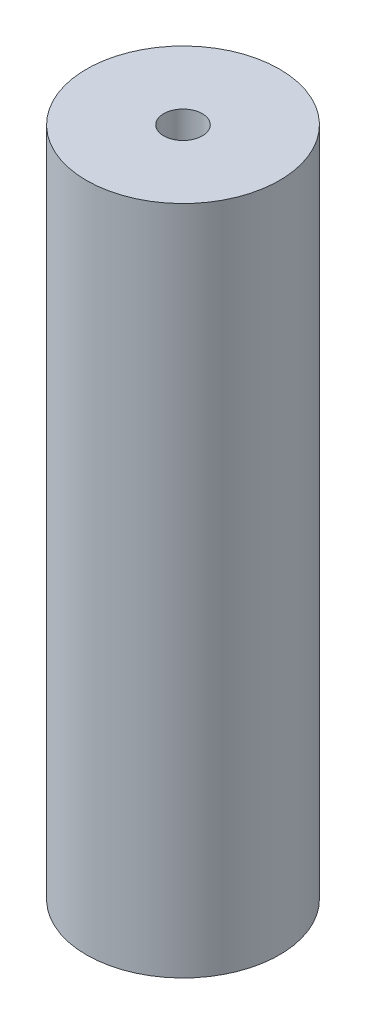
from build123d import *

# Parameters (mm, degrees)
ESBO_O1_R                = 20
ESBO_O1_R_2              = 4
RESSALTO_EXTRUS_O1_DEPTH = 139


with BuildPart() as part:
    # Esboço1 → Ressalto-extrusão1 (new body)
    with BuildSketch(Plane(origin=(0, 0, 0), x_dir=(1, 0, 0), z_dir=(0, 1, 0))):
        with Locations(Location((0, 0, 0), (0, 0, 270))):
            Circle(ESBO_O1_R)
        with Locations(Location((0, 0, 0), (0, 0, 270))):
            Circle(ESBO_O1_R_2, mode=Mode.SUBTRACT)
    extrude(amount=-RESSALTO_EXTRUS_O1_DEPTH)


solid = part.part
